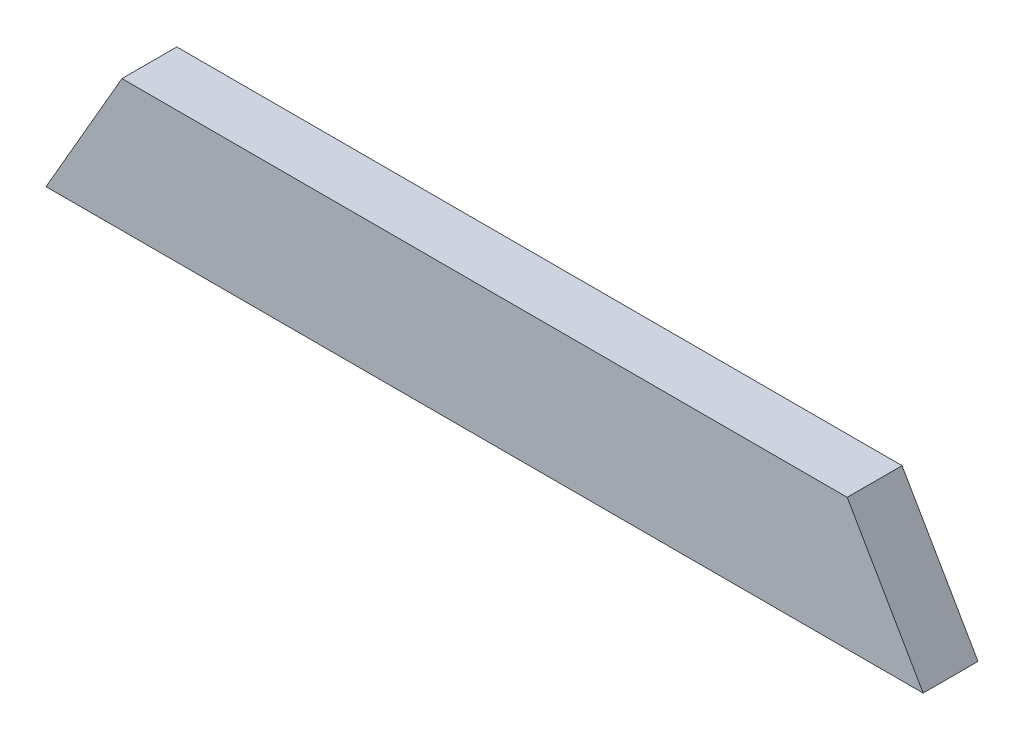
from build123d import *

# Parameters (mm, degrees)
BOSS_EXTRU_1_DEPTH = 25


with BuildPart() as part:
    # Esquisse1 → Boss.-Extru.1 (new body)
    with BuildSketch(Plane.XY):
        Polygon((-200, 0), (200, 0), (165.358983849, 60), (-165.358983849, 60), align=None)
    extrude(amount=BOSS_EXTRU_1_DEPTH)


solid = part.part
